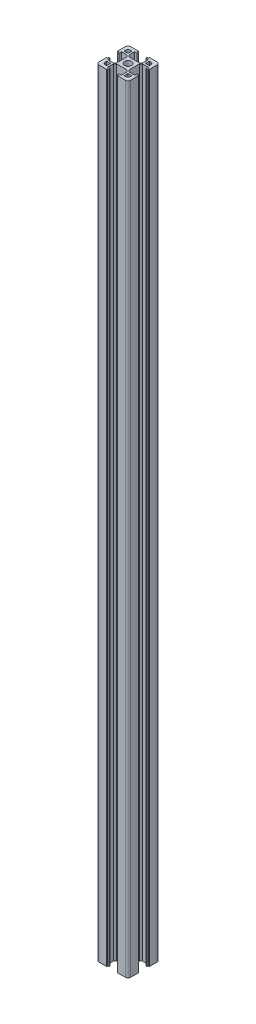
from build123d import *

# Parameters (mm, degrees)
SKETCH_1_R      = 3.4
EXTRUDE_1_DEPTH = 735


with BuildPart() as part:
    # 草图1 → 凸台-拉伸1 (new body)
    with BuildSketch(Plane(origin=(0, 0, 0), x_dir=(1, 0, 0), z_dir=(0, 1, 0))):
        with BuildLine():
            Line((-12.8, 4.1), (-12.8, 6.495575748))
            Line((-12.8, 6.495575748), (-7.273393207, 6.495575748))
            Line((-7.273393207, 6.495575748), (-5.8, 5.022182541))
            Line((-5.8, 5.022182541), (-5.8, 0))
            Line((-5.8, 0), (-5.8, -5.022182541))
            Line((-5.8, -5.022182541), (-7.273393207, -6.495575748))
            Line((-7.273393207, -6.495575748), (-12.8, -6.495575748))
            Line((-12.8, -6.495575748), (-12.8, -4.1))
            Line((-12.8, -4.1), (-14, -4.1))
            Line((-14, -4.1), (-14, -5.2))
            Line((-14, -5.2), (-15, -5.2))
            Line((-15, -5.2), (-15, -12.5))
            ThreePointArc((-15, -12.5), (-14.267766953, -14.267766953), (-12.5, -15))
            Line((-12.5, -15), (-5.2, -15))
            Line((-5.2, -15), (-5.2, -14))
            Line((-5.2, -14), (-4.1, -14))
            Line((-4.1, -14), (-4.1, -12.8))
            Line((-4.1, -12.8), (-6.495575748, -12.8))
            Line((-6.495575748, -12.8), (-6.495575748, -7.273393207))
            Line((-6.495575748, -7.273393207), (-5.022182541, -5.8))
            Line((-5.022182541, -5.8), (0, -5.8))
            Line((0, -5.8), (5.022182541, -5.8))
            Line((5.022182541, -5.8), (6.495575748, -7.273393207))
            Line((6.495575748, -7.273393207), (6.495575748, -12.8))
            Line((6.495575748, -12.8), (4.1, -12.8))
            Line((4.1, -12.8), (4.1, -14))
            Line((4.1, -14), (5.2, -14))
            Line((5.2, -14), (5.2, -15))
            Line((5.2, -15), (12.5, -15))
            ThreePointArc((12.5, -15), (14.267766953, -14.267766953), (15, -12.5))
            Line((15, -12.5), (15, -5.2))
            Line((15, -5.2), (14, -5.2))
            Line((14, -5.2), (14, -4.1))
            Line((14, -4.1), (12.8, -4.1))
            Line((12.8, -4.1), (12.8, -6.495575748))
            Line((12.8, -6.495575748), (7.273393207, -6.495575748))
            Line((7.273393207, -6.495575748), (5.8, -5.022182541))
            Line((5.8, -5.022182541), (5.8, 0))
            Line((5.8, 0), (5.8, 5.022182541))
            Line((5.8, 5.022182541), (7.273393207, 6.495575748))
            Line((7.273393207, 6.495575748), (12.8, 6.495575748))
            Line((12.8, 6.495575748), (12.8, 4.1))
            Line((12.8, 4.1), (14, 4.1))
            Line((14, 4.1), (14, 5.2))
            Line((14, 5.2), (15, 5.2))
            Line((15, 5.2), (15, 12.5))
            ThreePointArc((15, 12.5), (14.267766953, 14.267766953), (12.5, 15))
            Line((12.5, 15), (5.2, 15))
            Line((5.2, 15), (5.2, 14))
            Line((5.2, 14), (4.1, 14))
            Line((4.1, 14), (4.1, 12.8))
            Line((4.1, 12.8), (6.495575748, 12.8))
            Line((6.495575748, 12.8), (6.495575748, 7.273393207))
            Line((6.495575748, 7.273393207), (5.022182541, 5.8))
            Line((5.022182541, 5.8), (0, 5.8))
            Line((0, 5.8), (-5.022182541, 5.8))
            Line((-5.022182541, 5.8), (-6.495575748, 7.273393207))
            Line((-6.495575748, 7.273393207), (-6.495575748, 12.8))
            Line((-6.495575748, 12.8), (-4.1, 12.8))
            Line((-4.1, 12.8), (-4.1, 14))
            Line((-4.1, 14), (-5.2, 14))
            Line((-5.2, 14), (-5.2, 15))
            Line((-5.2, 15), (-12.5, 15))
            ThreePointArc((-12.5, 15), (-14.267766953, 14.267766953), (-15, 12.5))
            Line((-15, 12.5), (-15, 5.2))
            Line((-15, 5.2), (-14, 5.2))
            Line((-14, 5.2), (-14, 4.1))
            Line((-14, 4.1), (-12.8, 4.1))
        make_face()
        with Locations(Location((0, 0, 0), (0, 0, 270))):
            Circle(SKETCH_1_R, mode=Mode.SUBTRACT)
        with BuildLine():
            Line((-12, 9.5), (-12, 8.25))
            Line((-12, 8.25), (-8.25, 8.25))
            Line((-8.25, 8.25), (-8.25, 12))
            Line((-8.25, 12), (-9.5, 12))
            ThreePointArc((-9.5, 12), (-11.267766953, 11.267766953), (-12, 9.5))
        make_face(mode=Mode.SUBTRACT)
        with BuildLine():
            Line((9.5, 12), (8.25, 12))
            Line((8.25, 12), (8.25, 8.25))
            Line((8.25, 8.25), (12, 8.25))
            Line((12, 8.25), (12, 9.5))
            ThreePointArc((12, 9.5), (11.267766953, 11.267766953), (9.5, 12))
        make_face(mode=Mode.SUBTRACT)
        with BuildLine():
            Line((12, -9.5), (12, -8.25))
            Line((12, -8.25), (8.25, -8.25))
            Line((8.25, -8.25), (8.25, -12))
            Line((8.25, -12), (9.5, -12))
            ThreePointArc((9.5, -12), (11.267766953, -11.267766953), (12, -9.5))
        make_face(mode=Mode.SUBTRACT)
        with BuildLine():
            Line((-9.5, -12), (-8.25, -12))
            Line((-8.25, -12), (-8.25, -8.25))
            Line((-8.25, -8.25), (-12, -8.25))
            Line((-12, -8.25), (-12, -9.5))
            ThreePointArc((-12, -9.5), (-11.267766953, -11.267766953), (-9.5, -12))
        make_face(mode=Mode.SUBTRACT)
    extrude(amount=EXTRUDE_1_DEPTH)


solid = part.part
